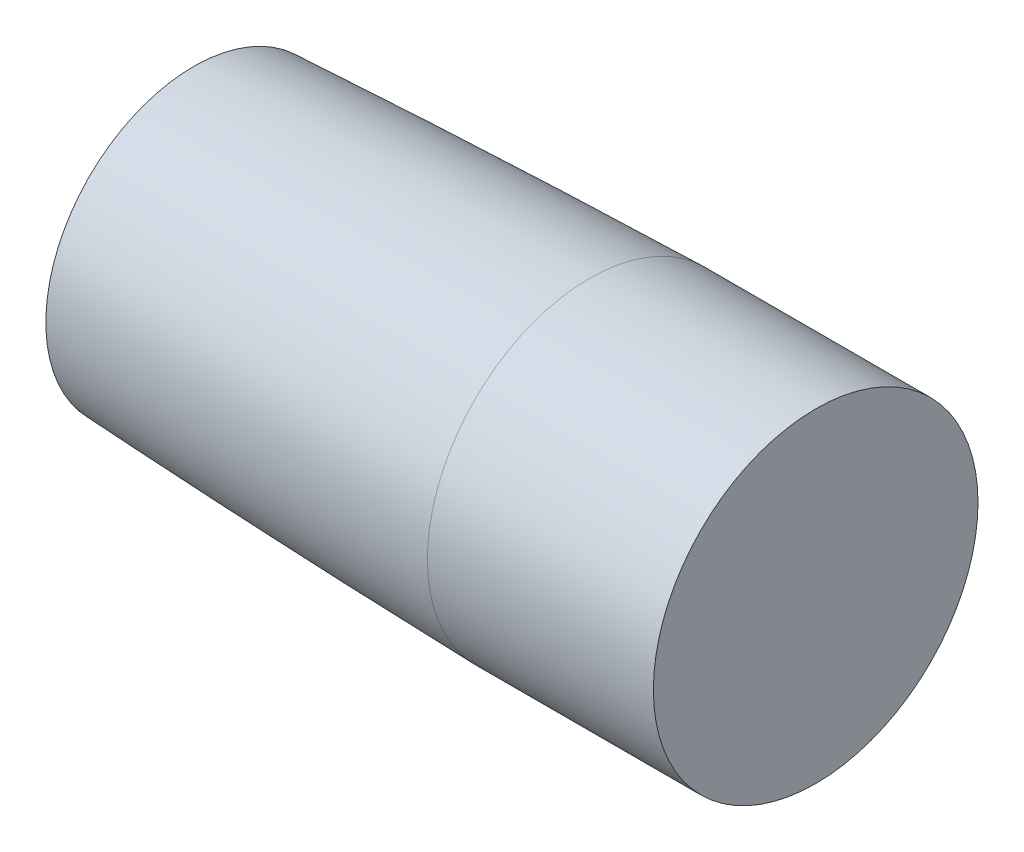
from build123d import *

# Parameters (mm, degrees)
SKETCH2_R          = 12.7
CUT_EXTRUDE1_DEPTH = 50.8


with BuildPart() as part:
    # Sketch1 → Revolve1 (revolve)
    with BuildSketch(Plane(origin=(0, 0, 0), x_dir=(1, 0, 0), z_dir=(0, 1, 0))):
        with BuildLine():
            Line((372.400000001, 44.273309897), (372.400000001, 0))
            Line((372.400000001, 0), (558.670000001, 0))
            Line((558.670000001, 0), (558.670000001, 48.604634376))
            Line((558.670000001, 48.604634376), (490.970000001, 48.604634376))
            add(Edge.make_bspline(
                [(372.400000001, 44.273309897), (373.24928915, 44.315565849), (374.969132917, 44.400501763), (378.947512637, 44.595596744), (382.338661842, 44.756728874), (386.793545067, 44.96704947), (390.662627743, 45.144419901), (395.609288848, 45.36822952), (401.393886451, 45.622164583), (408.312195722, 45.91704082), (416.18505041, 46.237850218), (424.336059228, 46.556325922), (432.504772067, 46.859794231), (440.61580108, 47.147817017), (448.84125804, 47.423666804), (456.867103281, 47.680468551), (465.238649858, 47.930660022), (472.357001173, 48.13371559), (479.399328002, 48.319565863), (484.034218998, 48.438607252), (488.446752277, 48.544979253), (490.119892859, 48.584748285), (490.970000001, 48.604634376)],
                knots=[0.082618084, 0.082618084, 0.082618084, 0.082618084, 0.082618084, 0.111284649, 0.139951213, 0.168617777, 0.197284341, 0.225950906, 0.25461747, 0.304731261, 0.36206439, 0.419397518, 0.476730647, 0.534063775, 0.591396904, 0.648730032, 0.70606316, 0.763396289, 0.820729417, 0.859302809, 0.887969373, 0.916635937, 0.916635937, 0.916635937, 0.916635937, 0.916635937], degree=4))
        make_face()
    revolve(axis=Axis((558.670000001, 0, 0), (-1, 0, 0)))

    # Sketch2 → Cut-Extrude1 (cut)
    with BuildSketch(Plane.ZY.offset(-372.4)):
        Circle(SKETCH2_R)
    extrude(amount=-CUT_EXTRUDE1_DEPTH, mode=Mode.SUBTRACT)


solid = part.part
